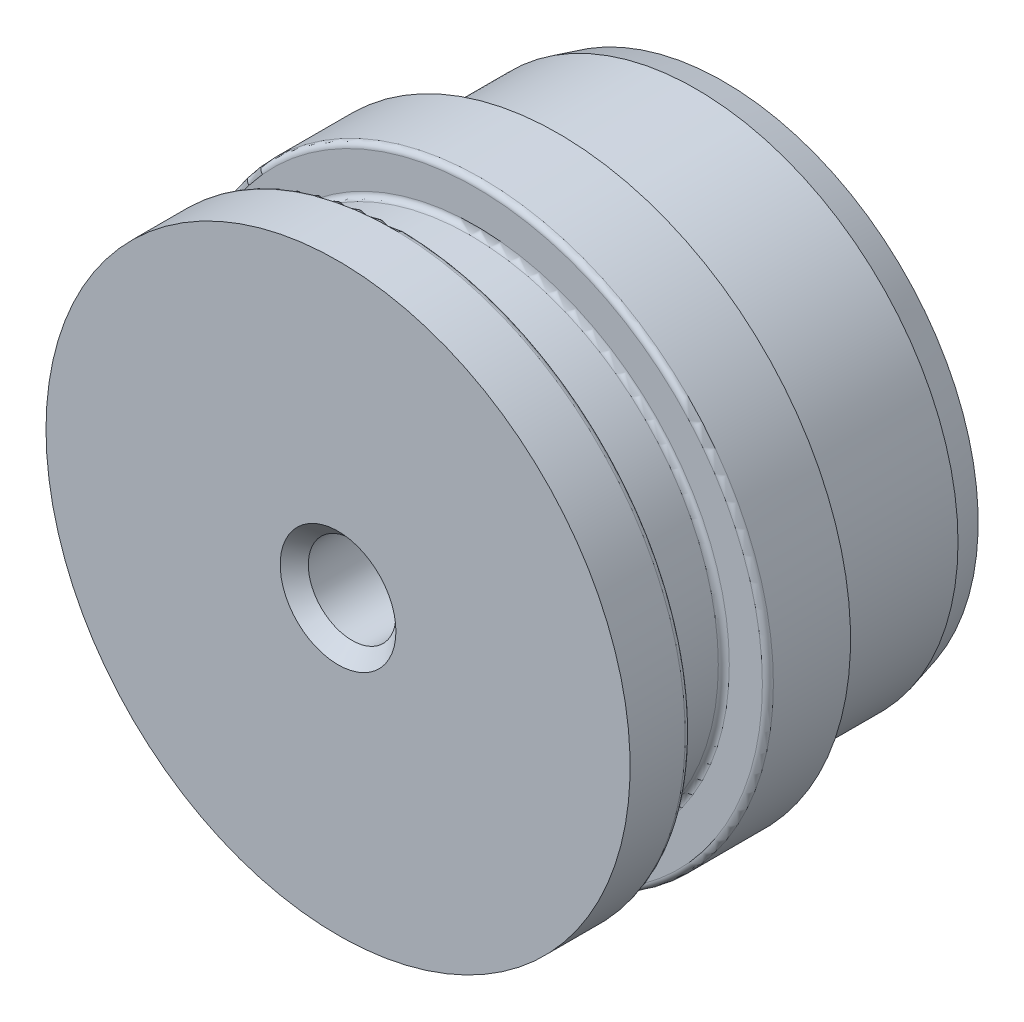
from build123d import *

# Parameters (mm, degrees)
F_6_32_TAPPED_HOLE1_D            = 2.7051
F_6_32_TAPPED_HOLE1_DEPTH        = 9.398
F_6_32_TAPPED_HOLE1_TIP          = 0.81269403
CHAMFER1_SIZE                    = 1.27
CHAMFER1_SIZE2                   = 0.462242198
F_10_32_TAPPED_HOLE2_D           = 4.0386
F_10_32_TAPPED_HOLE2_DEPTH       = 5.9944
F_10_32_TAPPED_HOLE2_CSINK_D     = 5.334
F_10_32_TAPPED_HOLE2_CSINK_ANGLE = 90
F_10_32_TAPPED_HOLE2_TIP         = 1.213317848
FILLET1_R                        = 0.254
CHAMFER2_SIZE                    = 1.27
CHAMFER2_SIZE2                   = 0.340295474


with BuildPart() as part:
    # Sketch1 → Revolve1 (revolve)
    with BuildSketch(Plane(origin=(0, 0, 0), x_dir=(0, 0, -1), z_dir=(1, 0, 0)), mode=Mode.PRIVATE) as revolve1_sk:
        Polygon((0, 0), (0, 13.462), (2.794, 13.462), (2.794, 11.43), (6.35, 11.43), (6.35, 13.462), (10.16, 13.462), (10.16, 12.065), (17.78, 12.065), (17.78, 5.5118), (12.192, 5.5118), (12.192, 0), align=None)
    revolve(revolve1_sk.sketch.rotate(Axis((0, 0, -12.192), (0, 0, 1)), 90), axis=Axis((0, 0, -12.192), (0, 0, 1)))

    # #6-32 Tapped Hole1
    with Locations(Plane(origin=(4.52225484, 6.077033904, -17.78), x_dir=(-1, 0, 0), z_dir=(0, 0, -1))):
        with Locations((-2.626784868, -1.949533904), (4.52225484, -14.332033904), (11.671294548, -1.949533904)):
            Hole(F_6_32_TAPPED_HOLE1_D / 2, depth=F_6_32_TAPPED_HOLE1_DEPTH)
            with Locations((0, 0, -(F_6_32_TAPPED_HOLE1_DEPTH + F_6_32_TAPPED_HOLE1_TIP / 2))):  # 118° drill point
                Cone(0, F_6_32_TAPPED_HOLE1_D / 2, F_6_32_TAPPED_HOLE1_TIP, mode=Mode.SUBTRACT)

    # Chamfer1
    chamfer1_edges = [part.edges().sort_by_distance(p)[0] for p in [
        (5.5118, 0, -17.78),
    ]]
    chamfer1_side = [part.faces().sort_by_distance(p)[0] for p in [
        (5.5118, 0, -14.986),
    ]]
    chamfer(chamfer1_edges, length=CHAMFER1_SIZE, length2=CHAMFER1_SIZE2, reference=chamfer1_side[0])

    # Sketch15 → Church tap on CL (revolve, cut)
    with BuildSketch(Plane(origin=(0, 0, 0), x_dir=(0, 0, -1), z_dir=(1, 0, 0)), mode=Mode.PRIVATE) as church_tap_on_cl_sk:
        Polygon((10.414, 0.508), (17.78, 0.508), (17.78, 0), (0, 0), (0, 2.0193), (6.604, 2.0193), (6.962810512, 1.422139028), (8.532276841, 0.8509), (10.414, 0.8509), align=None)
    revolve(church_tap_on_cl_sk.sketch.rotate(Axis((0, 0, -17.643825074), (0, 0, -1)), 90), axis=Axis((0, 0, -17.643825074), (0, 0, -1)), mode=Mode.SUBTRACT)

    # #10-32 Tapped Hole2
    with Locations(Plane.XY):
        with Locations((0, 0)):
            CounterSinkHole(F_10_32_TAPPED_HOLE2_D / 2, F_10_32_TAPPED_HOLE2_CSINK_D / 2, depth=F_10_32_TAPPED_HOLE2_DEPTH, counter_sink_angle=F_10_32_TAPPED_HOLE2_CSINK_ANGLE)
            with Locations((0, 0, -(F_10_32_TAPPED_HOLE2_DEPTH + F_10_32_TAPPED_HOLE2_TIP / 2))):  # 118° drill point
                Cone(0, F_10_32_TAPPED_HOLE2_D / 2, F_10_32_TAPPED_HOLE2_TIP, mode=Mode.SUBTRACT)

    # Fillet1
    fillet1_edges = [part.edges().sort_by_distance(p)[0] for p in [
        (11.43, 0, -2.794),
        (13.462, 0, -2.794),
        (13.462, 0, -6.35),
        (11.43, 0, -6.35),
    ]]
    fillet(fillet1_edges, radius=FILLET1_R)

    # Chamfer2
    chamfer2_edges = [part.edges().sort_by_distance(p)[0] for p in [
        (12.065, 0, -17.78),
    ]]
    chamfer2_side = [part.faces().sort_by_distance(p)[0] for p in [
        (12.065, 0, -13.97),
    ]]
    chamfer(chamfer2_edges, length=CHAMFER2_SIZE, length2=CHAMFER2_SIZE2, reference=chamfer2_side[0])


solid = part.part
